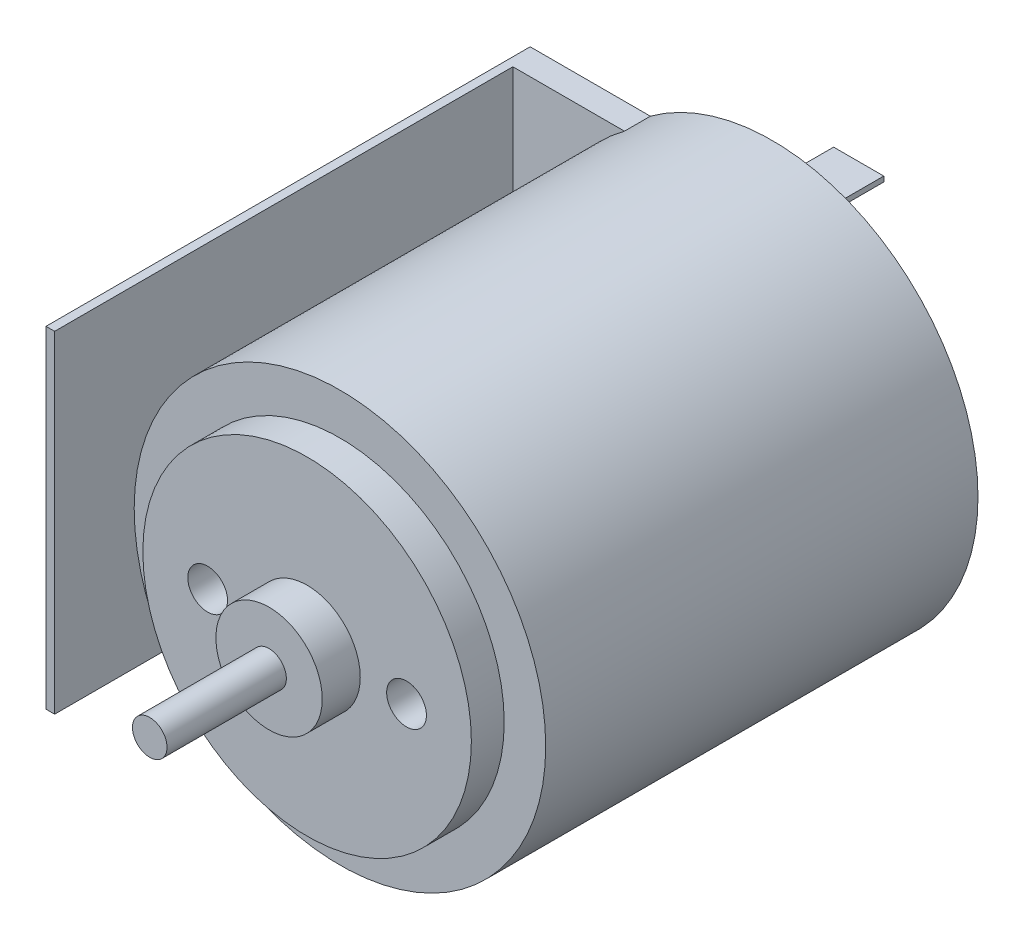
from build123d import *

# Parameters (mm, degrees)
SKETCH_2_R             = 1
EXTRUDE_1_DEPTH        = 36
SKETCH_2_4_R           = 3.075
SKETCH_2_4_R_2         = 1
EXTRUDE_2_DEPTH        = 29.1
EXTRUDE_3_DEPTH        = 26.9
EXTRUDE_3_DEPTH_BACK   = 2
SKETCH_2_5_R           = 4.25
SKETCH_2_5_R_2         = 3.075
SKETCH_2_6_R           = 9.5
SKETCH_2_6_R_2         = 4.25
EXTRUDE_4_DEPTH        = 26.9
SKETCH_2_7_R           = 11.9
SKETCH_2_7_R_2         = 9.5
EXTRUDE_5_DEPTH        = 25
SKETCH_5_W             = 2.9
SKETCH_5_H             = 0.3
EXTRUDE_6_DEPTH        = 5
HOLE_WIZARD_M2_2_D     = 1.6
HOLE_WIZARD_M2_2_DEPTH = 6
HOLE_WIZARD_M2_2_TIP   = 0.480688495
SKETCH_14_R            = 1.15
CUT_EXTRUDE_1_DEPTH    = 3
SKETCH_15_W            = 0.5
SKETCH_15_H            = 19.17801297
EXTRUDE_7_DEPTH        = 28
SKETCH_17_W            = 1.5
SKETCH_17_H            = 19.17801297
EXTRUDE_9_DEPTH        = 10


with BuildPart() as part:
    # ｽｹｯﾁ2 → ﾎﾞｽ - 押し出し1 (new body)
    with BuildSketch(Plane.XY):
        Circle(SKETCH_2_R)
    extrude(amount=EXTRUDE_1_DEPTH)

    # ｽｹｯﾁ2<4> → ﾎﾞｽ - 押し出し2 (add)
    with BuildSketch(Plane.XY):
        Circle(SKETCH_2_4_R)
        Circle(SKETCH_2_4_R_2, mode=Mode.SUBTRACT)
    extrude(amount=EXTRUDE_2_DEPTH)

    # ｽｹｯﾁ2<5> → ﾎﾞｽ - 押し出し3 (add, two sides: drawn at the far end of the back side and taken through both)
    with BuildSketch(Plane.XY.offset(-EXTRUDE_3_DEPTH_BACK)):
        Circle(SKETCH_2_5_R)
        Circle(SKETCH_2_5_R_2, mode=Mode.SUBTRACT)
    extrude(amount=EXTRUDE_3_DEPTH + EXTRUDE_3_DEPTH_BACK)

    # ｽｹｯﾁ2<6> → ﾎﾞｽ - 押し出し4 (add)
    with BuildSketch(Plane.XY):
        Circle(SKETCH_2_6_R)
        Circle(SKETCH_2_6_R_2, mode=Mode.SUBTRACT)
    extrude(amount=EXTRUDE_4_DEPTH)

    # ｽｹｯﾁ2<7> → ﾎﾞｽ - 押し出し5 (add)
    with BuildSketch(Plane.XY):
        Circle(SKETCH_2_7_R)
        Circle(SKETCH_2_7_R_2, mode=Mode.SUBTRACT)
    extrude(amount=EXTRUDE_5_DEPTH)

    # ｽｹｯﾁ5 → ﾎﾞｽ - 押し出し6 (add)
    with BuildSketch(Plane(origin=(0, 0, 0), x_dir=(-1, 0, 0), z_dir=(0, 0, -1))):
        with Locations((0, -7.656829655)):
            Rectangle(SKETCH_5_W, SKETCH_5_H)
        with Locations((0, 8.189714354)):
            Rectangle(SKETCH_5_W, SKETCH_5_H)
    extrude(amount=EXTRUDE_6_DEPTH)

    # M2 ねじ穴2
    with Locations(Plane(origin=(0, 0, 0), x_dir=(-1, 0, 0), z_dir=(0, 0, -1))):
        with Locations((-6.45, 0), (6.45, 0)):
            Hole(HOLE_WIZARD_M2_2_D / 2, depth=HOLE_WIZARD_M2_2_DEPTH)
            with Locations((0, 0, -(HOLE_WIZARD_M2_2_DEPTH + HOLE_WIZARD_M2_2_TIP / 2))):  # 118° drill point
                Cone(0, HOLE_WIZARD_M2_2_D / 2, HOLE_WIZARD_M2_2_TIP, mode=Mode.SUBTRACT)

    # ｽｹｯﾁ14 → ｶｯﾄ - 押し出し1 (cut)
    with BuildSketch(Plane.XY.offset(26.9)):
        with Locations((5.75, 0)):
            Circle(SKETCH_14_R)
        with Locations((-5.75, 0)):
            Circle(SKETCH_14_R)
    extrude(amount=-CUT_EXTRUDE_1_DEPTH, mode=Mode.SUBTRACT)



with BuildPart() as body_2:
    # ｽｹｯﾁ15 → ﾎﾞｽ - 押し出し7 (new body)
    with BuildSketch(Plane(origin=(0, 0, 0), x_dir=(-1, 0, 0), z_dir=(0, 0, -1))):
        with Locations((13.75, 0)):
            Rectangle(SKETCH_15_W, SKETCH_15_H)
    extrude(amount=-EXTRUDE_7_DEPTH)


with BuildPart() as part_1:
    add(part.part)

    add(body_2.part)  # ﾎﾞｽ - 押し出し9 merges body 2
    # ｽｹｯﾁ17 → ﾎﾞｽ - 押し出し9 (add)
    with BuildSketch(Plane.ZY.offset(14)):
        with Locations((0.75, 0)):
            Rectangle(SKETCH_17_W, SKETCH_17_H)
    extrude(amount=-EXTRUDE_9_DEPTH)


solid = part_1.part
